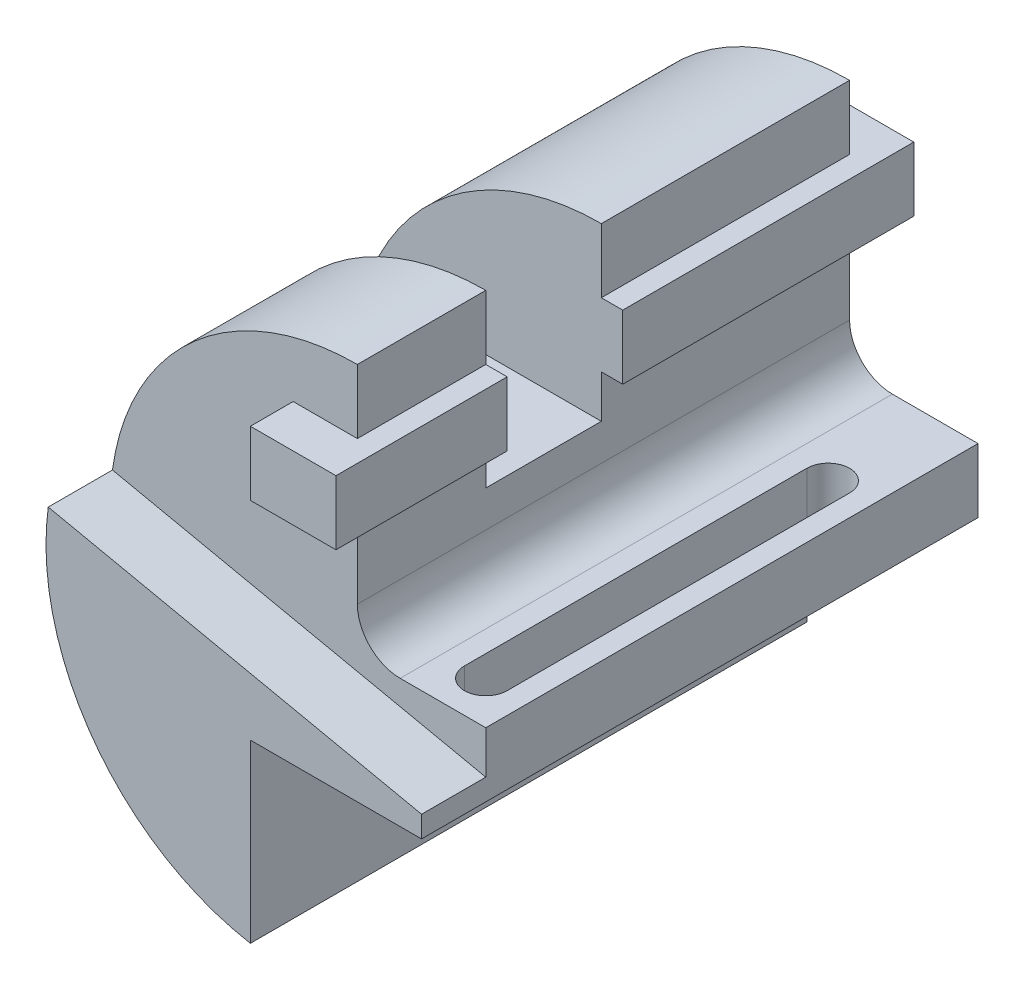
from build123d import *

# Parameters (mm, degrees)
BOSS_EXTRUDE1_DEPTH      = 115
BOSS_EXTRUDE2_DEPTH      = 5
BOSS_EXTRUDE2_DEPTH_BACK = 15
CUT_EXTRUDE1_DEPTH       = 177.194640768
CUT_EXTRUDE1_DEPTH_BACK  = 177.194640768
SKETCH8_W                = 27
SKETCH8_H                = 40
BOSS_EXTRUDE3_DEPTH      = 15
CUT_EXTRUDE2_DEPTH       = 151.340654848


with BuildPart() as part:
    # Sketch1 → Boss-Extrude1 (new body)
    with BuildSketch(Plane.XY):
        with BuildLine():
            Line((0, 0), (0, 41.12760983))
            Line((0, 41.12760983), (40, 41.12760983))
            Line((40, 41.12760983), (40, 56.12760983))
            Line((40, 56.12760983), (20, 56.12760983))
            ThreePointArc((20, 56.12760983), (12.928932188, 59.056542018), (10, 66.12760983))
            Line((10, 66.12760983), (10, 114.62760983))
            ThreePointArc((10, 114.62760983), (-47.531489063, 61.896600381), (0, 0))
        make_face()
    extrude(amount=BOSS_EXTRUDE1_DEPTH)

    # Sketch5 → Boss-Extrude2 (add, two sides: drawn at the far end of the back side and taken through both)
    with BuildSketch(Plane(origin=(10, 0, 0), x_dir=(0, 0, -1), z_dir=(1, 0, 0)).offset(-BOSS_EXTRUDE2_DEPTH_BACK)):
        Polygon((0, 99.62760983), (10, 99.62760983), (10, 84.62760983), (-125, 84.62760983), (-125, 99.62760983), align=None)
    extrude(amount=BOSS_EXTRUDE2_DEPTH + BOSS_EXTRUDE2_DEPTH_BACK)

    # Sketch8 → Cut-Extrude1 (cut, two sides: drawn at the far end of the back side and taken through both)
    with BuildSketch(Plane(origin=(0, 0, 0), x_dir=(0, 0, -1), z_dir=(1, 0, 0)).offset(-CUT_EXTRUDE1_DEPTH_BACK)):
        with Locations((-71.5, 94.62760983)):
            Rectangle(SKETCH8_W, SKETCH8_H)
    extrude(amount=CUT_EXTRUDE1_DEPTH + CUT_EXTRUDE1_DEPTH_BACK, mode=Mode.SUBTRACT)

    # Sketch9 → Boss-Extrude3 (add)
    with BuildSketch(Plane.XY.offset(115)):
        with BuildLine():
            Line((40, 46.12760983), (-47.222231128, 64.66726738))
            ThreePointArc((-47.222231128, 64.66726738), (-36.638728081, 22.82042934), (0, 0))
            Line((0, 0), (0, 41.12760983))
            Line((0, 41.12760983), (40, 41.12760983))
            Line((40, 41.12760983), (40, 46.12760983))
        make_face()
    extrude(amount=BOSS_EXTRUDE3_DEPTH)

    # Sketch10 → Cut-Extrude2 (cut, through all)
    with BuildSketch(Plane(origin=(0, 56.12760983, 0), x_dir=(1, 0, 0), z_dir=(0, 1, 0))):
        with BuildLine():
            Line((25, -105), (25, -25))
            ThreePointArc((25, -25), (30, -20), (35, -25))
            Line((35, -25), (35, -105))
            ThreePointArc((35, -105), (30, -110), (25, -105))
        make_face()
    extrude(amount=-CUT_EXTRUDE2_DEPTH, mode=Mode.SUBTRACT)


solid = part.part
